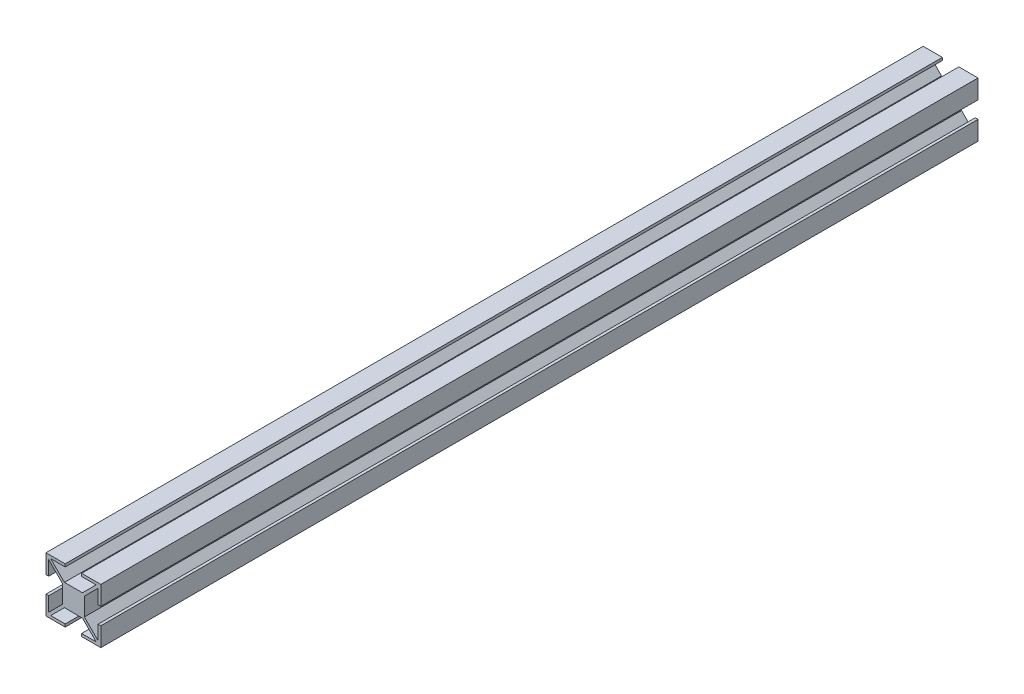
from build123d import *

# Parameters (mm, degrees)
BOSS_EXTRUDE1_DEPTH = 320.01


with BuildPart() as part:
    # Sketch2 → Boss-Extrude1 (new body)
    with BuildSketch(Plane.XY):
        Polygon((-10, 10), (-3, 10), (-3, 9), (-8.292893219, 9), (-3.292893219, 4), (3.292893219, 4), (8.292893219, 9), (3, 9), (3, 10), (10, 10), (10, 3.074044586), (9, 3.074044586), (9, 8.292893219), (4, 3.292893219), (4, -3.292893219), (9, -8.292893219), (9, -3.074044586), (10, -3.074044586), (10, -10), (3, -10), (3, -9), (8.292893219, -9), (3.292893219, -4), (-3.292893219, -4), (-8.292893219, -9), (-3, -9), (-3, -10), (-10, -10), (-10, -3.074044586), (-9, -3.074044586), (-9, -8.292893219), (-4, -3.292893219), (-4, 3.292893219), (-9, 8.292893219), (-9, 3.074044586), (-10, 3.074044586), align=None)
    extrude(amount=BOSS_EXTRUDE1_DEPTH)


solid = part.part
